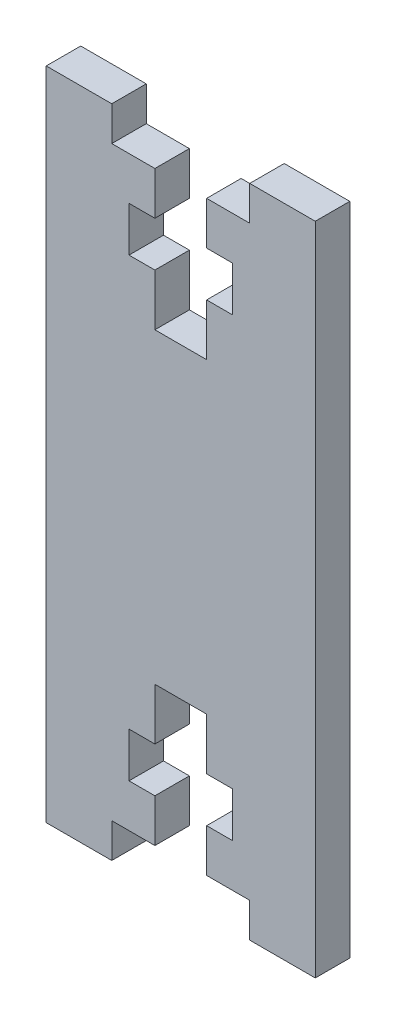
from build123d import *

# Parameters (mm, degrees)
EXTRUDE_1_DEPTH = 2


with BuildPart() as part:
    # 草图2 → 凸台-拉伸1 (new body)
    with BuildSketch(Plane.XY):
        Polygon((6, -27.5), (6, -29.5), (9.8, -29.5), (9.8, 8.5), (6, 8.5), (6, 6.5), (3.5, 6.5), (3.5, 4), (5, 4), (5, 1.4), (3.5, 1.4), (3.5, -1.6), (0.5, -1.6), (0.5, 1.4), (-1, 1.4), (-1, 4), (0.5, 4), (0.5, 6.5), (-2, 6.5), (-2, 8.5), (-5.8, 8.5), (-5.8, -29.5), (-2, -29.5), (-2, -27.5), (0.5, -27.5), (0.5, -25), (-1, -25), (-1, -22.4), (0.5, -22.4), (0.5, -19.4), (3.5, -19.4), (3.5, -22.4), (5, -22.4), (5, -25), (3.5, -25), (3.5, -27.5), align=None)
    extrude(amount=EXTRUDE_1_DEPTH)


solid = part.part
